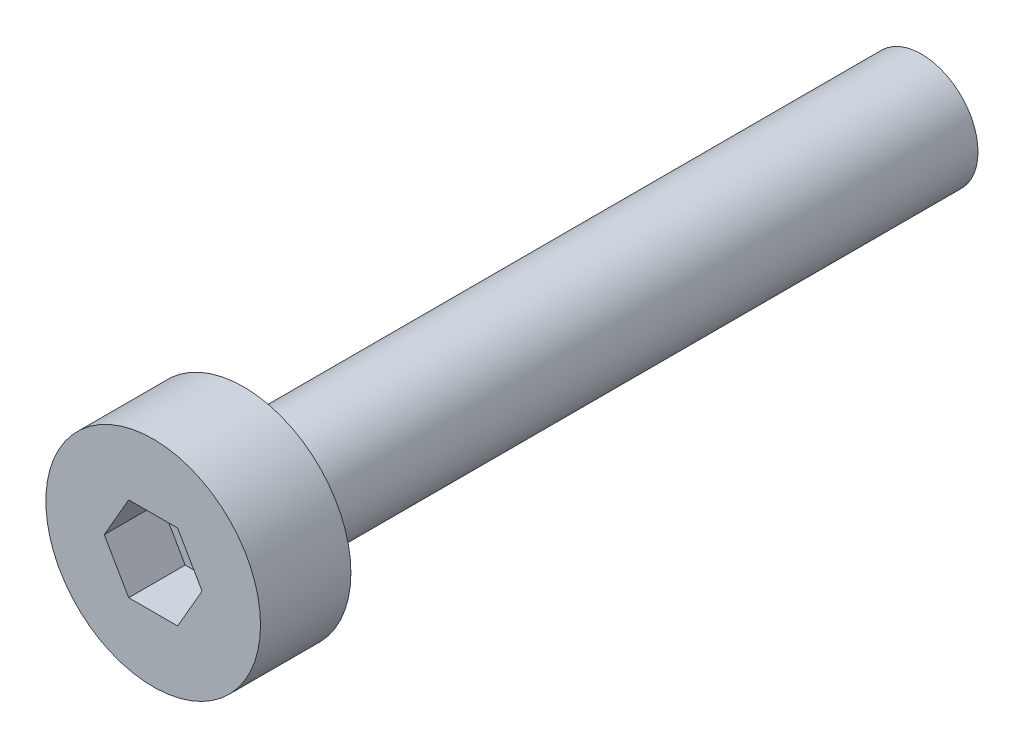
from build123d import *

# Parameters (mm, degrees)
ESQUISSE1_R             = 1
BOSS_EXTRU_1_DEPTH      = 12
ESQUISSE2_R             = 1.9
BOSS_EXTRU_2_DEPTH      = 1.6
ENL_V_MAT_EXTRU_1_DEPTH = 1


with BuildPart() as part:
    # Esquisse1 → Boss.-Extru.1 (new body)
    with BuildSketch(Plane.XY):
        Circle(ESQUISSE1_R)
    extrude(amount=BOSS_EXTRU_1_DEPTH)

    # Esquisse2 → Boss.-Extru.2 (add)
    with BuildSketch(Plane.XY.offset(12)):
        Circle(ESQUISSE2_R)
    extrude(amount=BOSS_EXTRU_2_DEPTH)

    # Esquisse3 → Enlèv. mat.-Extru.1 (cut)
    with BuildSketch(Plane.XY.offset(13.6)):
        Polygon((0.866025404, 0), (0.433012702, 0.75), (-0.433012702, 0.75), (-0.866025404, 0), (-0.433012702, -0.75), (0.433012702, -0.75), align=None)
    extrude(amount=-ENL_V_MAT_EXTRU_1_DEPTH, mode=Mode.SUBTRACT)


solid = part.part
